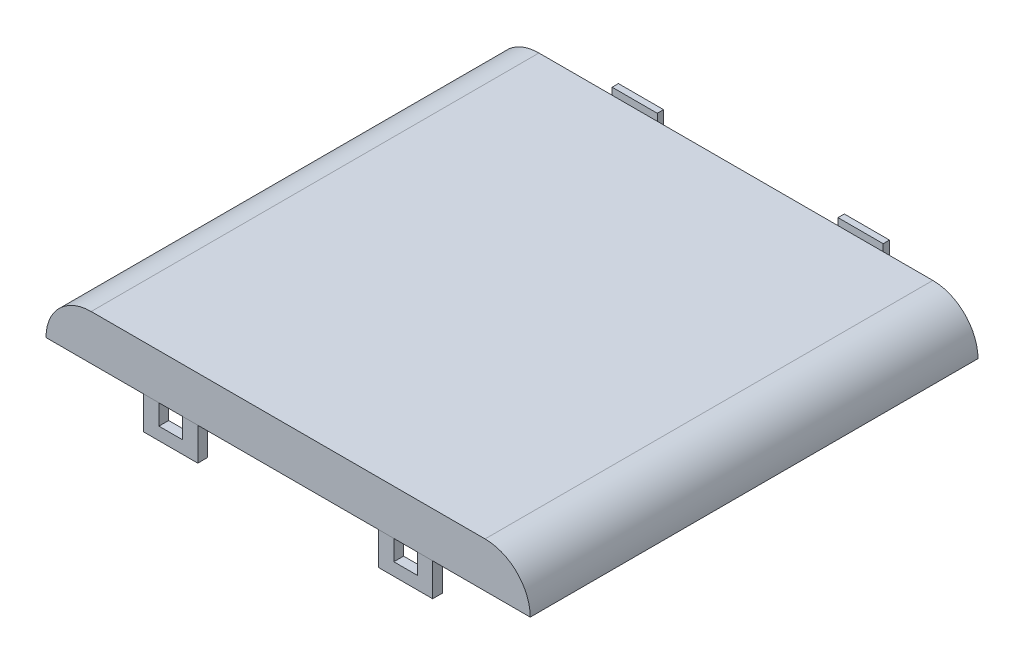
from build123d import *

# Parameters (mm, degrees)
SKETCH1_W                = 68.072
SKETCH1_H                = 62.9412
BOSS_EXTRUDE1_DEPTH      = 18.9103
FILLET1_R                = 6.35
CUT_EXTRUDE13_DEPTH      = 78.342066784
CUT_EXTRUDE13_DEPTH_BACK = 78.342066784
SKETCH36_W               = 62.9412
SKETCH36_H               = 12.5603
BOSS_EXTRUDE2_DEPTH      = 1.3716
BOSS_EXTRUDE2_2_DEPTH    = 1.3716
SHELL1_T                 = -1.3716
CUT_EXTRUDE14_DEPTH      = 1.3716
SKETCH41_W               = 6.35
SKETCH41_H               = 3.6449
BOSS_EXTRUDE4_DEPTH      = 2.54
SKETCH42_W               = 38.1
SKETCH42_H               = 1.27
CUT_EXTRUDE15_DEPTH      = 2.54
SKETCH43_W               = 1.654238959
SKETCH43_H               = 1.41141074
CUT_EXTRUDE16_DEPTH      = 66.821301677


with BuildPart() as part:
    # Sketch1 → Boss-Extrude1 (new body)
    with BuildSketch(Plane(origin=(0, 0, 0), x_dir=(1, 0, 0), z_dir=(0, 1, 0))):
        Rectangle(SKETCH1_W, SKETCH1_H)
    extrude(amount=BOSS_EXTRUDE1_DEPTH)

    # Fillet1
    fillet1_edges = [part.edges().sort_by_distance(p)[0] for p in [
        (34.036, 18.9103, 0),
        (-34.036, 18.9103, 0),
        (34.036, 0, 0),
        (-34.036, 0, 0),
    ]]
    fillet(fillet1_edges, radius=FILLET1_R)

    # Sketch36 → Cut-Extrude13 (cut, two sides: drawn at the far end of the back side and taken through both)
    with BuildSketch(Plane(origin=(34.036, 0, 0), x_dir=(0, 0, -1), z_dir=(1, 0, 0)).offset(-CUT_EXTRUDE13_DEPTH_BACK)):
        with Locations((0, 6.28015)):
            Rectangle(SKETCH36_W, SKETCH36_H)
    extrude(amount=CUT_EXTRUDE13_DEPTH + CUT_EXTRUDE13_DEPTH_BACK, mode=Mode.SUBTRACT)

    # Shell1
    shell1_openings = [part.faces().sort_by_distance(p)[0] for p in [
        (0, 12.5603, 0),
    ]]
    offset(amount=SHELL1_T, openings=shell1_openings, kind=Kind.INTERSECTION)

    # Sketch40 → Cut-Extrude14 (cut)
    with BuildSketch(Plane(origin=(0, 0, -31.4706), x_dir=(-1, 0, 0), z_dir=(0, 0, -1))):
        with BuildLine():
            Line((27.686, 15.8623), (-27.686, 15.8623))
            ThreePointArc((-27.686, 15.8623), (-30.020866591, 14.895166591), (-30.988, 12.5603))
            Line((-30.988, 12.5603), (30.988, 12.5603))
            ThreePointArc((30.988, 12.5603), (30.020866591, 14.895166591), (27.686, 15.8623))
        make_face()
    extrude(amount=-CUT_EXTRUDE14_DEPTH, mode=Mode.SUBTRACT)

    # Sketch41 → Boss-Extrude4 (add)
    with BuildSketch(Plane(origin=(0, 0, -31.4706), x_dir=(-1, 0, 0), z_dir=(0, 0, -1))):
        with Locations((-15.875, 17.68475)):
            Rectangle(SKETCH41_W, SKETCH41_H)
        with Locations((15.875, 17.68475)):
            Rectangle(SKETCH41_W, SKETCH41_H)
    extrude(amount=BOSS_EXTRUDE4_DEPTH)

    # Sketch42 → Cut-Extrude15 (cut)
    with BuildSketch(Plane(origin=(0, 0, -34.0106), x_dir=(-1, 0, 0), z_dir=(0, 0, -1))):
        with Locations((0, 18.8722)):
            Rectangle(SKETCH42_W, SKETCH42_H)
    extrude(amount=-CUT_EXTRUDE15_DEPTH, mode=Mode.SUBTRACT)

    # Sketch43 → Cut-Extrude16 (cut, through all)
    with BuildSketch(Plane.ZY.offset(19.05)):
        with Locations((-32.29771948, 17.53149463)):
            Rectangle(SKETCH43_W, SKETCH43_H)
    extrude(amount=-CUT_EXTRUDE16_DEPTH, mode=Mode.SUBTRACT)


with BuildPart() as body_2:
    # Sketch37 → Boss-Extrude2 (new body)
    with BuildSketch(Plane.XY.offset(31.4706)):
        Polygon((-18.161, 12.5603), (-20.32, 12.5603), (-20.32, 7.9375), (-12.7, 7.9375), (-12.7, 12.5603), (-14.859, 12.5603), (-14.859, 9.7155), (-18.161, 9.7155), align=None)
    extrude(amount=-BOSS_EXTRUDE2_DEPTH)


with BuildPart() as body_3:
    # Sketch37 → Boss-Extrude2 2 (new body)
    with BuildSketch(Plane.XY.offset(31.4706)):
        Polygon((14.859, 12.5603), (12.7, 12.5603), (12.7, 7.9375), (20.32, 7.9375), (20.32, 12.5603), (18.161, 12.5603), (18.161, 9.7155), (14.859, 9.7155), align=None)
    extrude(amount=-BOSS_EXTRUDE2_2_DEPTH)


solid = Compound([part.part, body_2.part, body_3.part])
